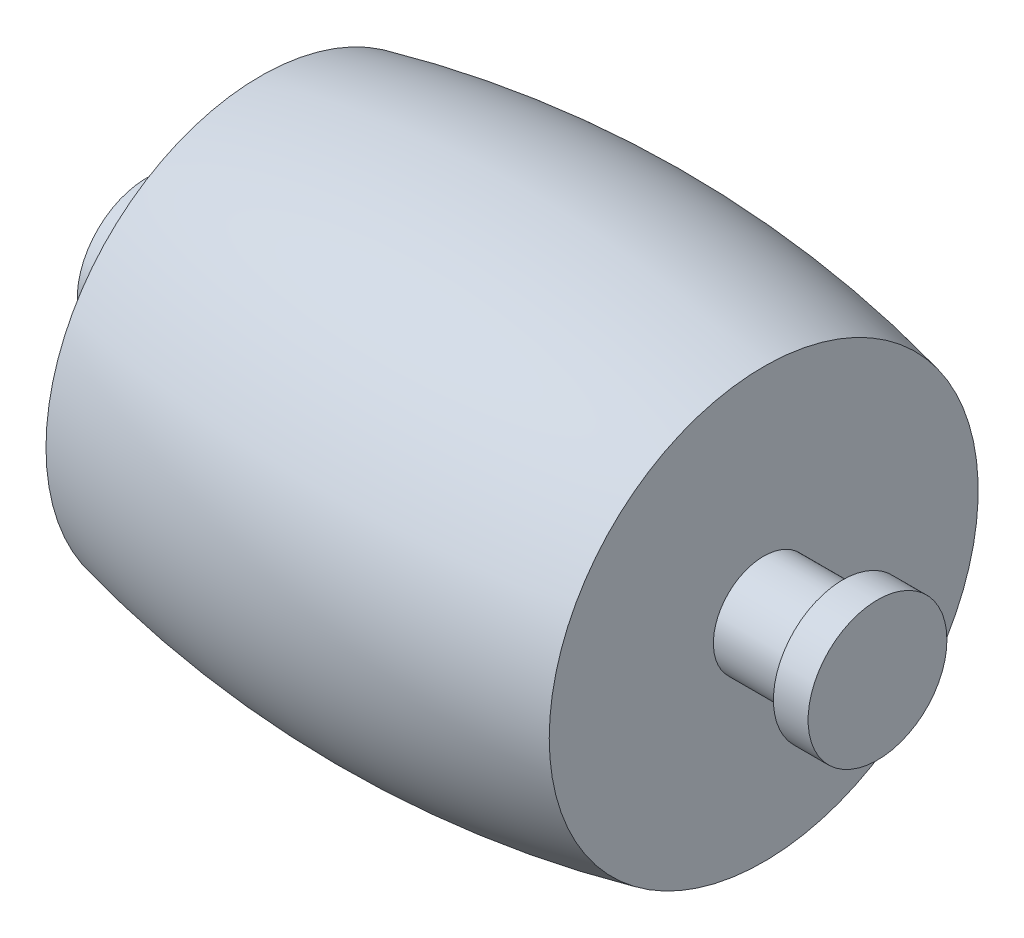
from build123d import *

# Parameters (mm, degrees)
SKETCH4_R           = 3.683
BOSS_EXTRUDE1_DEPTH = 5.789022458
SKETCH5_R           = 5.08
BOSS_EXTRUDE2_DEPTH = 2.54


with BuildPart() as part:
    # Sketch2 → Revolve1 (revolve)
    with BuildSketch(Plane.XY, mode=Mode.PRIVATE) as revolve1_sk:
        with BuildLine():
            Line((-18.415, 0), (-18.415, 15.697572511))
            ThreePointArc((-18.415, 15.697572511), (-9.266184884, 17.257739329), (0, 17.78))
            ThreePointArc((0, 17.78), (9.266184884, 17.257739329), (18.415, 15.697572511))
            Line((18.415, 15.697572511), (18.415, 0))
            Line((18.415, 0), (-18.415, 0))
        make_face()
    revolve(revolve1_sk.sketch.rotate(Axis((-18.415, 0, 0), (1, 0, 0)), 90), axis=Axis((-18.415, 0, 0), (1, 0, 0)))

    # Sketch4 → Boss-Extrude1 (add)
    with BuildSketch(Plane(origin=(18.415, 0, 0), x_dir=(0, 0, -1), z_dir=(1, 0, 0))):
        Circle(SKETCH4_R)
    boss_extrude1 = extrude(amount=BOSS_EXTRUDE1_DEPTH)

    # Sketch5 → Boss-Extrude2 (add)
    with BuildSketch(Plane(origin=(24.204022458, 0, 0), x_dir=(0, 0, -1), z_dir=(1, 0, 0))):
        Circle(SKETCH5_R)
    boss_extrude2 = extrude(amount=BOSS_EXTRUDE2_DEPTH)

    # Mirror1: Boss-Extrude1, Boss-Extrude2 across plane
    add(boss_extrude1.mirror(Plane(origin=(0, 0, 0), x_dir=(0, 0, 1), z_dir=(1, 0, 0))))
    add(boss_extrude2.mirror(Plane(origin=(0, 0, 0), x_dir=(0, 0, 1), z_dir=(1, 0, 0))))


solid = part.part
